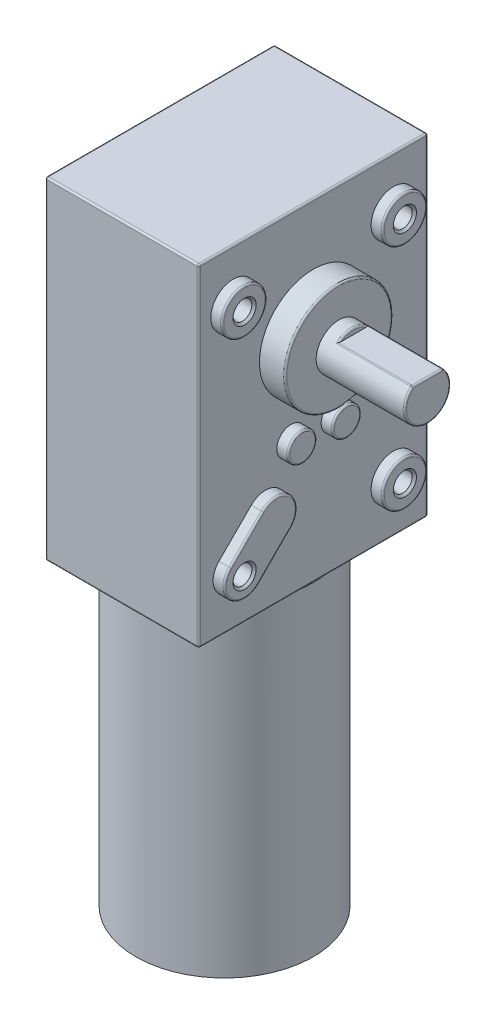
from build123d import *

# Parameters (mm, degrees)
EXTRUDE_1_DEPTH             = 58
SKETCH_3_R                  = 2.4999999999999996
SKETCH_3_R_2                = 2.499999999999999
EXTRUDE_2_DEPTH             = 2
SKETCH_4_R                  = 9.4
EXTRUDE_3_DEPTH             = 4.5
SKETCH_5_R                  = 4.000000000000001
EXTRUDE_4_DEPTH             = 15.5
CUT_EXTRUDE_START           = -13
CUT_EXTRUDE_1_DEPTH         = 13
FILLET_1_R                  = 0.3
SKETCH_7_R                  = 15.5
EXTRUDE_5_DEPTH             = 56.6
SKETCH_8_R                  = 6
EXTRUDE_6_DEPTH             = 2
SKETCH_9_R                  = 1.0000000000000002
EXTRUDE_7_DEPTH             = 1
HOLE_WIZARD_M4_5_AT_2_COUNT = 2
HOLE_WIZARD_M4_5_AT_2_PITCH = 28
HOLE_WIZARD_M4_5_AT_3_COUNT = 2
HOLE_WIZARD_M4_5_AT_3_PITCH = 39.99999999999999
HOLE_WIZARD_M4_5_AT_4_COUNT = 2
HOLE_WIZARD_M4_5_AT_4_PITCH = 48.8262224629348


with BuildPart() as part:
    # 草图2 → 凸台-拉伸1 (new body)
    with BuildSketch(Plane(origin=(0, 0, 0), x_dir=(1, 0, 0), z_dir=(0, 1, 0))):
        Polygon((-13.400000000000004, 19.999999999999996), (13.399999999999997, 19.999999999999996), (13.400000000000002, -20.000000000000004), (-13.4, -20.000000000000004), align=None)
    extrude(amount=EXTRUDE_1_DEPTH)

    # 草图3 → 凸台-拉伸2 (add)
    with BuildSketch(Plane(origin=(13.399999999999999, 0, -1.74e-15), x_dir=(-1.3e-16, 0, -1), z_dir=(1, 0, -1.3e-16))):
        with BuildLine():
            Line((-14.000000000000012, 45.1), (-14.000000000000012, 49))
            Line((-14.000000000000012, 49), (-10.10000000000001, 49))
            ThreePointArc((-10.10000000000001, 49), (-16.75771644662754, 51.75771644662755), (-14.000000000000037, 45.1))
        make_face()
        with BuildLine():
            Line((-10.10000000000001, 49), (-14.000000000000012, 49))
            Line((-14.000000000000012, 49), (-14.000000000000012, 45.1))
            ThreePointArc((-14.000000000000037, 45.1), (-11.242283553372484, 46.24228355337245), (-10.10000000000001, 49))
        make_face()
        with BuildLine():
            ThreePointArc((17.899999999999988, 49), (13.999999999999988, 52.9), (10.099999999999985, 49))
            Line((10.099999999999985, 49), (13.999999999999988, 49))
            Line((13.999999999999988, 49), (13.999999999999988, 45.1))
            ThreePointArc((13.999999999999963, 45.1), (16.757716446627516, 46.24228355337245), (17.899999999999988, 49))
        make_face()
        with BuildLine():
            Line((13.999999999999988, 49), (10.099999999999985, 49))
            ThreePointArc((10.099999999999985, 49), (11.242283553372442, 46.242283553372474), (13.999999999999963, 45.1))
            Line((13.999999999999988, 45.1), (13.999999999999988, 49))
        make_face()
        with BuildLine():
            Line((-10.81801948466056, 17.131727983645305), (-14.000000000000007, 13.949747468305842))
            Line((-14.000000000000007, 13.949747468305844), (-14.000000000000007, 9.000000000000007))
            Line((-14.000000000000007, 9.000000000000005), (-9.050252531694188, 9.000000000000005))
            Line((-9.050252531694188, 9.000000000000005), (-5.868272016354716, 12.181980515339479))
            ThreePointArc((-5.868272016354716, 12.181980515339479), (-5.868272016354725, 17.131727983645316), (-10.81801948466056, 17.131727983645305))
        make_face()
        with BuildLine():
            Line((-14.000000000000007, 9.000000000000007), (-14.000000000000007, 13.949747468305844))
            Line((-14.000000000000007, 13.949747468305842), (-16.474873734152926, 11.474873734152911))
            ThreePointArc((-16.474873734152926, 11.474873734152911), (-16.47487373415292, 6.52512626584709), (-11.525126265847096, 6.525126265847091))
            Line((-11.525126265847097, 6.525126265847093), (-9.050252531694188, 9.000000000000005))
            Line((-9.050252531694188, 9.000000000000005), (-14.000000000000007, 9.000000000000005))
        make_face()
        with BuildLine():
            ThreePointArc((17.89999999999999, 9.000000000000005), (16.75771644662752, 11.75771644662755), (13.999999999999968, 12.900000000000007))
            Line((13.999999999999991, 12.900000000000006), (13.999999999999991, 9.000000000000007))
            Line((13.999999999999993, 9.000000000000005), (10.099999999999987, 9.000000000000005))
            ThreePointArc((10.099999999999989, 9.000000000000005), (13.999999999999991, 5.100000000000003), (17.89999999999999, 9.000000000000004))
        make_face()
        with BuildLine():
            Line((13.999999999999991, 9.000000000000007), (13.999999999999991, 12.900000000000006))
            ThreePointArc((13.999999999999968, 12.900000000000007), (11.242283553372445, 11.757716446627533), (10.099999999999989, 9.000000000000005))
            Line((10.099999999999987, 9.000000000000005), (13.999999999999993, 9.000000000000005))
        make_face()
        with Locations(Location((-3.8772522969191674, 23.377984169467222, 0), (0, 0, 180))):
            Circle(SKETCH_3_R)
        with Locations(Location((3.8772522969191545, 23.377984169467222, 0), (0, 0, 180))):
            Circle(SKETCH_3_R_2)
    extrude_2 = extrude(amount=EXTRUDE_2_DEPTH)

    # 草图4 → 凸台-拉伸3 (add)
    with BuildSketch(Plane(origin=(13.399999999999999, 0, -1.74e-15), x_dir=(-1.3e-16, 0, -1), z_dir=(1, 0, -1.3e-16))):
        with Locations(Location((1.73e-15, 38.00000000000001, 0), (0, 0, 180))):
            Circle(SKETCH_4_R)
    extrude_3 = extrude(amount=EXTRUDE_3_DEPTH)

    # 镜向1: 凸台-拉伸2, 凸台-拉伸3 across plane
    add(extrude_2.mirror(Plane(origin=(0, 0, 0), x_dir=(1.1e-16, 0, 1), z_dir=(1, 0, -1.1e-16))))
    add(extrude_3.mirror(Plane(origin=(0, 0, 0), x_dir=(1.1e-16, 0, 1), z_dir=(1, 0, -1.1e-16))))

    # 草图5 → 凸台-拉伸4 (add)
    with BuildSketch(Plane(origin=(17.9, 0, -2.33e-15), x_dir=(-1.3e-16, 0, -1), z_dir=(1, 0, -1.3e-16))):
        with Locations((1.73e-15, 38.00000000000001)):
            Circle(SKETCH_5_R)
    extrude(amount=EXTRUDE_4_DEPTH)

    # 草图6 → 切除-拉伸1 (cut)
    with BuildSketch(Plane(origin=(33.4, 0, -4.35e-15), x_dir=(-1.3e-16, 0, -1), z_dir=(1, 0, -1.3e-16)).offset(CUT_EXTRUDE_START)):
        with BuildLine():
            Line((-2.6457513110645885, 41.00000000000001), (2.6457513110645885, 41.00000000000001))
            ThreePointArc((2.6457513110645885, 41.00000000000001), (2e-16, 42.00000000000001), (-2.6457513110645885, 41.00000000000001))
        make_face()
    extrude(amount=CUT_EXTRUDE_1_DEPTH, mode=Mode.SUBTRACT)

    # 圆角1
    fillet_1_edges = [part.edges().sort_by_distance(p)[0] for p in [
        (-13.400000000000002, 58, 3.55e-15),
        (15.4, 52.9, 13.999999999999977),
        (0, 58, 20.000000000000004),
        (15.399999999999997, 49, -17.899999999999988),
        (15.4, 14.303300858899108, 13.646446609406741),
        (15.399999999999999, 9.353553390593285, 8.696699141100904),
        (15.399999999999999, 17.131727983645316, 5.868272016354721),
        (15.4, 6.5251262658470885, 16.474873734152915),
        (15.399999999999997, 9.000000000000004, -10.099999999999993),
        (15.399999999999999, 23.377984169467222, 1.3772522969191658),
        (15.399999999999999, 23.377984169467222, -6.377252296919155),
        (17.9, 38.00000000000001, -9.400000000000004),
        (13.399999999999999, 58, 3.55e-15),
        (0, 0, 20.000000000000004),
        (-15.399999999999997, 52.9, 13.99999999999998),
        (-13.400000000000002, 0, 3.55e-15),
        (-15.4, 49, -17.899999999999984),
        (-3.55e-15, 0, -19.999999999999996),
        (-15.399999999999999, 9.353553390593285, 8.696699141100908),
        (-15.399999999999995, 6.5251262658470885, 16.47487373415292),
        (-15.399999999999999, 17.131727983645316, 5.868272016354726),
        (-15.399999999999997, 14.303300858899108, 13.646446609406743),
        (13.399999999999999, 0, 3.55e-15),
        (-15.4, 9.000000000000004, -10.099999999999989),
        (-15.399999999999999, 23.377984169467222, 1.377252296919169),
        (-15.399999999999999, 23.377984169467222, -6.377252296919152),
        (13.400000000000002, 29, 20.000000000000004),
        (-13.4, 29, 20.000000000000004),
        (-13.400000000000004, 29, -19.999999999999996),
        (-17.9, 38.00000000000001, -9.399999999999999),
        (13.399999999999997, 29, -19.999999999999996),
        (-3.55e-15, 58, -19.999999999999996),
        (33.4, 34.354248688935414, 1.6457513110645863),
        (20.4, 42.00000000000001, -2.88e-15),
        (26.9, 41.00000000000001, 2.6457513110645845),
        (26.9, 41.00000000000001, -2.6457513110645916),
        (33.4, 41.00000000000001, -4.35e-15),
    ]]
    fillet(fillet_1_edges, radius=FILLET_1_R)

    # 草图7 → 凸台-拉伸5 (add)
    with BuildSketch(Plane.XZ):
        with Locations(Location((-2.1000000000000045, 0, 0), (0, 0, 135.20867534))):
            Circle(SKETCH_7_R)
    extrude(amount=EXTRUDE_5_DEPTH)

    # 草图8 → 凸台-拉伸6 (add)
    with BuildSketch(Plane.XZ.offset(56.6)):
        with Locations(Location((-2.1000000000000045, 0, 0), (0, 0, 270))):
            Circle(SKETCH_8_R)
    extrude(amount=EXTRUDE_6_DEPTH)

    # 草图9 → 凸台-拉伸7 (add)
    with BuildSketch(Plane.XZ.offset(58.60000000000001)):
        with Locations(Location((-2.1000000000000045, 0, 0), (0, 0, 270))):
            Circle(SKETCH_9_R)
    extrude(amount=EXTRUDE_7_DEPTH)

    # 草图14 → M4 螺纹孔5 (revolve, cut)
    with BuildSketch(Plane(origin=(15.399999999999997, 49, -13.99999999999999), x_dir=(-1.3e-16, 0, -1), z_dir=(0, 1, 0))):
        Polygon((0, 0), (-2.72e-15, 11.091420021395477), (1.649999999999998, 10.1), (1.6499999999999986, 0.37500000000000033), (2.025, 0), align=None)
    hole_wizard_m4_5 = revolve(axis=Axis((21.749999999999986, 49, -13.99999999999999), (-1, 0, 1.2e-16)), mode=Mode.SUBTRACT)

    # M4 螺纹孔5 at 2: M4 螺纹孔5 ×2
    with Locations(*[(0, 0, i * HOLE_WIZARD_M4_5_AT_2_PITCH) for i in range(1, HOLE_WIZARD_M4_5_AT_2_COUNT)]):
        add(hole_wizard_m4_5, mode=Mode.SUBTRACT)

    # M4 螺纹孔5 at 3: M4 螺纹孔5 ×2
    with Locations(*[(0, -i * HOLE_WIZARD_M4_5_AT_3_PITCH, 0) for i in range(1, HOLE_WIZARD_M4_5_AT_3_COUNT)]):
        add(hole_wizard_m4_5, mode=Mode.SUBTRACT)

    # M4 螺纹孔5 at 4: M4 螺纹孔5 ×2
    with Locations(*[Vector(0, -0.8192319205190405, 0.5734623443633283) * (i * HOLE_WIZARD_M4_5_AT_4_PITCH) for i in range(1, HOLE_WIZARD_M4_5_AT_4_COUNT)]):
        add(hole_wizard_m4_5, mode=Mode.SUBTRACT)

    # 镜向2: M4 螺纹孔5 across plane
    add(hole_wizard_m4_5.mirror(Plane(origin=(0, 0, 0), x_dir=(1.1e-16, 0, 1), z_dir=(1, 0, -1.1e-16))), mode=Mode.SUBTRACT)

    # 镜向2 copy 1 sketch → 镜向2 copy 1 (revolve, cut)
    with BuildSketch(Plane(origin=(-15.399999999999999, 49, 14.000000000000014), x_dir=(-9e-17, 0, -1), z_dir=(0, 1, 0))):
        Polygon((0, 0), (-2.72e-15, -11.091420021395477), (1.649999999999998, -10.1), (1.6499999999999986, -0.37500000000000033), (2.025, 0), align=None)
    revolve(axis=Axis((-21.749999999999986, 49, 14.000000000000016), (-1, 0, 9e-17)), mode=Mode.SUBTRACT)

    # 镜向2 copy 2 sketch → 镜向2 copy 2 (revolve, cut)
    with BuildSketch(Plane(origin=(-15.4, 9.000000000000007, -13.99999999999999), x_dir=(-9e-17, 0, -1), z_dir=(0, 1, 0))):
        Polygon((0, 0), (-2.72e-15, -11.091420021395477), (1.649999999999998, -10.1), (1.6499999999999986, -0.37500000000000033), (2.025, 0), align=None)
    revolve(axis=Axis((-21.74999999999999, 9.000000000000007, -13.999999999999988), (-1, 0, 9e-17)), mode=Mode.SUBTRACT)

    # 镜向2 copy 3 sketch → 镜向2 copy 3 (revolve, cut)
    with BuildSketch(Plane(origin=(-15.399999999999999, 9.000000000000007, 14.000000000000007), x_dir=(-9e-17, 0, -1), z_dir=(0, 1, 0))):
        Polygon((0, 0), (-2.72e-15, -11.091420021395477), (1.649999999999998, -10.1), (1.6499999999999986, -0.37500000000000033), (2.025, 0), align=None)
    revolve(axis=Axis((-21.749999999999986, 9.000000000000007, 14.000000000000009), (-1, 0, 9e-17)), mode=Mode.SUBTRACT)


solid = part.part
